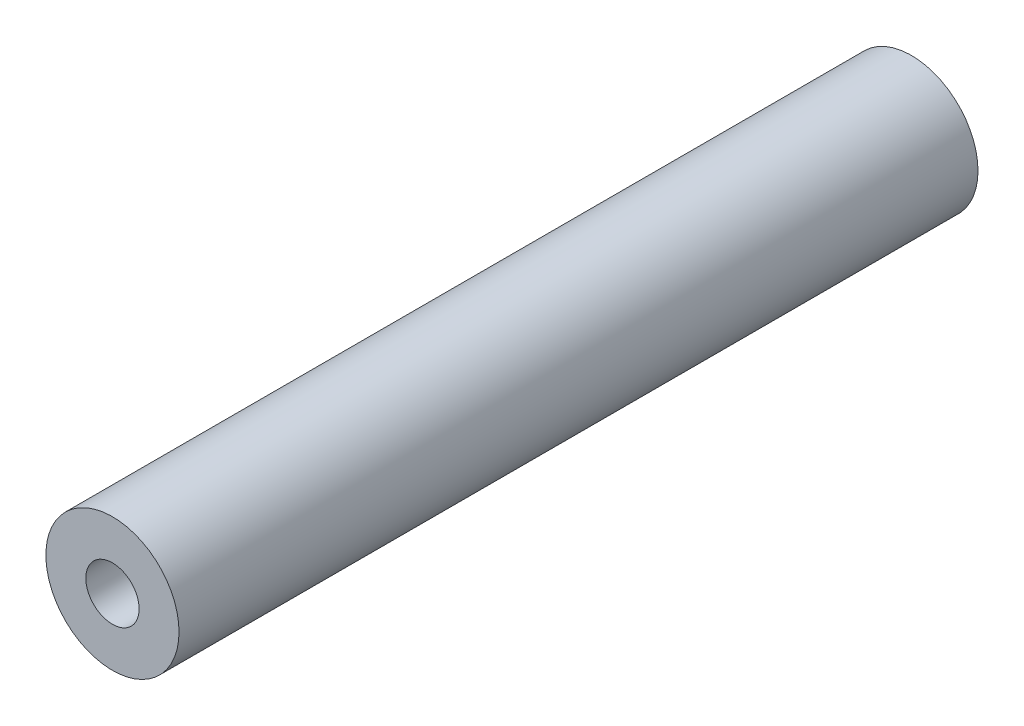
from build123d import *

# Parameters (mm, degrees)
ESBO_O1_R                = 5
ESBO_O1_R_2              = 2
RESSALTO_EXTRUS_O1_DEPTH = 60


with BuildPart() as part:
    # Esboço1 → Ressalto-extrusão1 (new body)
    with BuildSketch(Plane.XY):
        Circle(ESBO_O1_R)
        Circle(ESBO_O1_R_2, mode=Mode.SUBTRACT)
    extrude(amount=RESSALTO_EXTRUS_O1_DEPTH)


solid = part.part
